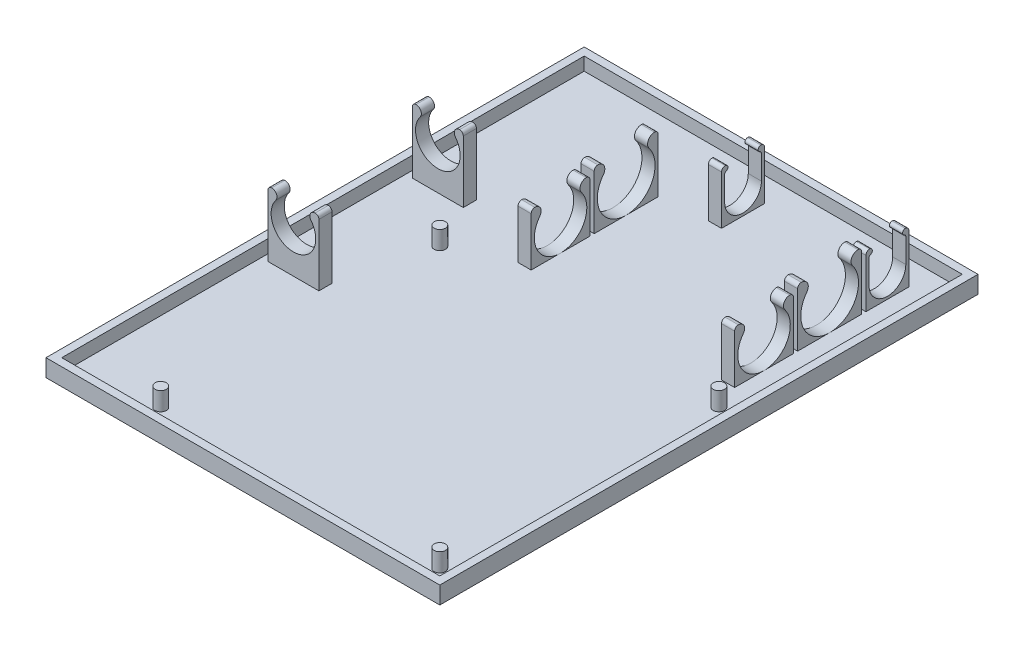
from build123d import *

# Parameters (mm, degrees)
SKETCH1_W           = 150
SKETCH1_H           = 205
SKETCH1_W_2         = 144
SKETCH1_H_2         = 199
BASE_DEPTH          = 1.6
WALLS_START         = 1.6
SKETCH1_3_W         = 150
SKETCH1_3_H         = 205
SKETCH1_3_W_2       = 144
SKETCH1_3_H_2       = 199
WALLS_DEPTH         = 5
SKETCH4_R           = 2.15
FANPEG_DEPTH        = 7
SKETCH6_W           = 5
SKETCH6_H           = 22.4
SUCKEREXTRUDE_DEPTH = 20
SUCKERCUT_DEPTH     = 5
LPATTERN1_COUNT     = 2
LPATTERN1_PITCH     = 77.5
SKETCH10_W          = 5
SKETCH10_H          = 24.4
BOSS_EXTRUDE5_DEPTH = 22
CUT_EXTRUDE2_DEPTH  = 5
LPATTERN2_COUNT     = 2
LPATTERN2_PITCH     = 77.5
SKETCH12_W          = 5
SKETCH12_H          = 16.4
BOSS_EXTRUDE6_DEPTH = 20
CUT_EXTRUDE3_DEPTH  = 5
LPATTERN3_COUNT     = 2
LPATTERN3_PITCH     = 55
SKETCH14_W          = 19.4
SKETCH14_H          = 5
BOSS_EXTRUDE7_DEPTH = 25
CUT_EXTRUDE4_DEPTH  = 5
LPATTERN4_COUNT     = 2
LPATTERN4_PITCH     = 55


with BuildPart() as part:
    # Sketch1 → Base (new body)
    # profile 1 of 2: a face of its own
    with BuildSketch(Plane(origin=(0, 0, 0), x_dir=(1, 0, 0), z_dir=(0, 1, 0))):
        Rectangle(SKETCH1_W, SKETCH1_H)
        Rectangle(SKETCH1_W_2, SKETCH1_H_2, mode=Mode.SUBTRACT)
    # profile 2 of 2: a face of its own
    with BuildSketch(Plane(origin=(0, 0, 0), x_dir=(1, 0, 0), z_dir=(0, 1, 0))):
        Rectangle(SKETCH1_W_2, SKETCH1_H_2)
    extrude(amount=BASE_DEPTH)



with BuildPart() as body_2:
    # Sketch1<3> → Walls (new body)
    with BuildSketch(Plane(origin=(0, 0, 0), x_dir=(1, 0, 0), z_dir=(0, 1, 0)).offset(WALLS_START)):
        Rectangle(SKETCH1_3_W, SKETCH1_3_H)
        Rectangle(SKETCH1_3_W_2, SKETCH1_3_H_2, mode=Mode.SUBTRACT)
    extrude(amount=WALLS_DEPTH)


with BuildPart() as part_1:
    add(part.part)

    add(body_2.part)  # FanPeg merges body 2
    # Sketch4 → FanPeg (add)
    with BuildSketch(Plane(origin=(0, 1.6, 0), x_dir=(1, 0, 0), z_dir=(0, 1, 0))):
        with Locations(Location((64.5, 14.3, 0), (0, 0, 270))):
            Circle(SKETCH4_R)
    fanpeg = extrude(amount=FANPEG_DEPTH)

    # Sketch-Pattern1: FanPeg at 3 more places
    with Locations((-106.3, 0, 0), (-106.3, 0, 106.3), (0, 0, 106.3)):
        add(fanpeg)

    # Sketch6 → SuckerExtrude (add)
    with BuildSketch(Plane(origin=(0, 1.6, 0), x_dir=(1, 0, 0), z_dir=(0, 1, 0))):
        with Locations((58.5, 35)):
            Rectangle(SKETCH6_W, SKETCH6_H)
    suckerextrude = extrude(amount=SUCKEREXTRUDE_DEPTH)

    # Sketch7 → suckerCut (cut)
    with BuildSketch(Plane(origin=(61, 0, 0), x_dir=(0, 0, -1), z_dir=(1, 0, 0))):
        with BuildLine():
            Line((46.2, 21.6), (44.785786438, 21.6))
            ThreePointArc((44.785786438, 21.6), (45.785786438, 21.185786438), (46.2, 20.185786438))
            Line((46.2, 20.185786438), (46.2, 21.6))
        make_face()
        with BuildLine():
            Line((44.785786438, 21.6), (35, 21.6))
            ThreePointArc((35, 21.6), (39.395004096, 20.582423893), (42.89555796, 17.7367878))
            ThreePointArc((42.89555796, 17.7367878), (42.635357864, 20.258141333), (44.785786438, 21.6))
        make_face()
        with BuildLine():
            ThreePointArc((27.10444204, 17.7367878), (30.604995904, 20.582423893), (35, 21.6))
            Line((35, 21.6), (25.214213562, 21.6))
            ThreePointArc((25.214213562, 21.6), (27.364642136, 20.258141333), (27.10444204, 17.7367878))
        make_face()
        with BuildLine():
            ThreePointArc((23.8, 20.185786438), (24.214213562, 21.185786438), (25.214213562, 21.6))
            Line((25.214213562, 21.6), (23.8, 21.6))
            Line((23.8, 21.6), (23.8, 20.185786438))
        make_face()
        with BuildLine():
            ThreePointArc((27.10444204, 17.7367878), (26.017576107, 7.204995904), (35, 1.6))
            Line((35, 1.6), (35, 21.6))
            ThreePointArc((35, 21.6), (30.604995904, 20.582423893), (27.10444204, 17.7367878))
        make_face()
        with BuildLine():
            Line((35, 21.6), (35, 1.6))
            ThreePointArc((35, 1.6), (42.071067812, 4.528932188), (45, 11.6))
            ThreePointArc((45, 11.6), (44.459270046, 14.843795647), (42.89555796, 17.7367878))
            ThreePointArc((42.89555796, 17.7367878), (39.395004096, 20.582423893), (35, 21.6))
        make_face()
    suckercut = extrude(amount=-SUCKERCUT_DEPTH, mode=Mode.SUBTRACT)

    # LPattern1: SuckerExtrude, suckerCut ×2
    with Locations(*[(-i * LPATTERN1_PITCH, 0, 0) for i in range(1, LPATTERN1_COUNT)]):
        add(suckerextrude)
        add(suckercut, mode=Mode.SUBTRACT)

    # Sketch10 → Boss-Extrude5 (add)
    with BuildSketch(Plane(origin=(0, 1.6, 0), x_dir=(1, 0, 0), z_dir=(0, 1, 0))):
        with Locations((58.5, 60)):
            Rectangle(SKETCH10_W, SKETCH10_H)
    boss_extrude5 = extrude(amount=BOSS_EXTRUDE5_DEPTH)

    # Sketch11 → Cut-Extrude2 (cut)
    with BuildSketch(Plane(origin=(61, 0, 0), x_dir=(0, 0, -1), z_dir=(1, 0, 0))):
        with BuildLine():
            ThreePointArc((51.304294464, 19.336817144), (50.123133377, 7.757737542), (60, 1.6))
            Line((60, 1.6), (60, 23.6))
            ThreePointArc((60, 23.6), (55.157737542, 22.476866623), (51.304294464, 19.336817144))
        make_face()
        with BuildLine():
            Line((60, 23.6), (60, 1.6))
            ThreePointArc((60, 1.6), (67.778174593, 4.821825407), (71, 12.6))
            ThreePointArc((71, 12.6), (70.407995986, 16.160002746), (68.695705536, 19.336817144))
            ThreePointArc((68.695705536, 19.336817144), (64.842262458, 22.476866623), (60, 23.6))
        make_face()
        with BuildLine():
            ThreePointArc((51.304294464, 19.336817144), (55.157737542, 22.476866623), (60, 23.6))
            Line((60, 23.6), (49.214213562, 23.6))
            ThreePointArc((49.214213562, 23.6), (51.588195778, 22.119939575), (51.304294464, 19.336817144))
        make_face()
        with BuildLine():
            ThreePointArc((47.8, 22.185786438), (48.214213562, 23.185786438), (49.214213562, 23.6))
            Line((49.214213562, 23.6), (47.8, 23.6))
            Line((47.8, 23.6), (47.8, 22.185786438))
        make_face()
        with BuildLine():
            Line((70.785786438, 23.6), (60, 23.6))
            ThreePointArc((60, 23.6), (64.842262458, 22.476866623), (68.695705536, 19.336817144))
            ThreePointArc((68.695705536, 19.336817144), (68.411804222, 22.119939575), (70.785786438, 23.6))
        make_face()
        with BuildLine():
            Line((72.2, 23.6), (70.785786438, 23.6))
            ThreePointArc((70.785786438, 23.6), (71.785786438, 23.185786438), (72.2, 22.185786438))
            Line((72.2, 22.185786438), (72.2, 23.6))
        make_face()
    cut_extrude2 = extrude(amount=-CUT_EXTRUDE2_DEPTH, mode=Mode.SUBTRACT)

    # LPattern2: Boss-Extrude5, Cut-Extrude2 ×2
    with Locations(*[(-i * LPATTERN2_PITCH, 0, 0) for i in range(1, LPATTERN2_COUNT)]):
        add(boss_extrude5)
        add(cut_extrude2, mode=Mode.SUBTRACT)

    # Sketch12 → Boss-Extrude6 (add)
    with BuildSketch(Plane(origin=(0, 1.6, 0), x_dir=(1, 0, 0), z_dir=(0, 1, 0))):
        with Locations((58.5, 82)):
            Rectangle(SKETCH12_W, SKETCH12_H)
    boss_extrude6 = extrude(amount=BOSS_EXTRUDE6_DEPTH)

    # Sketch13 → Cut-Extrude3 (cut)
    with BuildSketch(Plane(origin=(61, 0, 0), x_dir=(0, 0, -1), z_dir=(1, 0, 0))):
        with BuildLine():
            Line((75, 18.77951536), (75, 9.6))
            ThreePointArc((75, 9.6), (77.050252532, 14.549747468), (82, 16.6))
            Line((82, 16.6), (82, 21.6))
            Line((82, 21.6), (75.214213562, 21.6))
            ThreePointArc((75.214213562, 21.6), (76.230059772, 20.749616137), (75.571668571, 19.6))
            ThreePointArc((75.571668571, 19.6), (75.157009996, 19.27951536), (75, 18.77951536))
        make_face()
        with BuildLine():
            Line((82, 21.6), (82, 16.6))
            ThreePointArc((82, 16.6), (86.949747468, 14.549747468), (89, 9.6))
            Line((89, 9.6), (89, 18.77951536))
            ThreePointArc((89, 18.77951536), (88.842990004, 19.27951536), (88.428331429, 19.6))
            ThreePointArc((88.428331429, 19.6), (87.769940228, 20.749616137), (88.785786438, 21.6))
            Line((88.785786438, 21.6), (82, 21.6))
        make_face()
        with BuildLine():
            ThreePointArc((82, 16.6), (77.050252532, 14.549747468), (75, 9.6))
            ThreePointArc((75, 9.6), (77.050252532, 4.650252532), (82, 2.6))
            Line((82, 2.6), (82, 16.6))
        make_face()
        with BuildLine():
            ThreePointArc((89, 9.6), (86.949747468, 14.549747468), (82, 16.6))
            Line((82, 16.6), (82, 2.6))
            ThreePointArc((82, 2.6), (86.949747468, 4.650252532), (89, 9.6))
        make_face()
        with BuildLine():
            Line((90.2, 21.6), (88.785786438, 21.6))
            ThreePointArc((88.785786438, 21.6), (89.785786438, 21.185786438), (90.2, 20.185786438))
            Line((90.2, 20.185786438), (90.2, 21.6))
        make_face()
        with BuildLine():
            ThreePointArc((73.8, 20.185786438), (74.214213562, 21.185786438), (75.214213562, 21.6))
            Line((75.214213562, 21.6), (73.8, 21.6))
            Line((73.8, 21.6), (73.8, 20.185786438))
        make_face()
    cut_extrude3 = extrude(amount=-CUT_EXTRUDE3_DEPTH, mode=Mode.SUBTRACT)

    # LPattern3: Boss-Extrude6, Cut-Extrude3 ×2
    with Locations(*[(-i * LPATTERN3_PITCH, 0, 0) for i in range(1, LPATTERN3_COUNT)]):
        add(boss_extrude6)
        add(cut_extrude3, mode=Mode.SUBTRACT)

    # Sketch14 → Boss-Extrude7 (add)
    with BuildSketch(Plane(origin=(0, 1.6, 0), x_dir=(1, 0, 0), z_dir=(0, 1, 0))):
        with Locations((-59.75, -21)):
            Rectangle(SKETCH14_W, SKETCH14_H)
    boss_extrude7 = extrude(amount=BOSS_EXTRUDE7_DEPTH)

    # Sketch15 → Cut-Extrude4 (cut)
    with BuildSketch(Plane.XY.offset(23.5)):
        with BuildLine():
            ThreePointArc((-53.054728703, 23.336730111), (-56.025903193, 25.740752775), (-59.75, 26.6))
            Line((-59.75, 26.6), (-59.75, 9.6))
            ThreePointArc((-59.75, 9.6), (-53.73959236, 12.08959236), (-51.25, 18.1))
            ThreePointArc((-51.25, 18.1), (-51.713837793, 20.869493995), (-53.054728703, 23.336730111))
        make_face()
        with BuildLine():
            Line((-59.75, 9.6), (-59.75, 26.6))
            ThreePointArc((-59.75, 26.6), (-63.474096807, 25.740752775), (-66.445271297, 23.336730111))
            ThreePointArc((-66.445271297, 23.336730111), (-67.390752775, 14.375903193), (-59.75, 9.6))
        make_face()
        with BuildLine():
            ThreePointArc((-66.445271297, 23.336730111), (-63.474096807, 25.740752775), (-59.75, 26.6))
            Line((-59.75, 26.6), (-68.035786438, 26.6))
            ThreePointArc((-68.035786438, 26.6), (-66.220664625, 25.465446074), (-66.445271297, 23.336730111))
        make_face()
        with BuildLine():
            Line((-51.464213562, 26.6), (-59.75, 26.6))
            ThreePointArc((-59.75, 26.6), (-56.025903193, 25.740752775), (-53.054728703, 23.336730111))
            ThreePointArc((-53.054728703, 23.336730111), (-53.279335375, 25.465446074), (-51.464213562, 26.6))
        make_face()
        with BuildLine():
            Line((-50.05, 26.6), (-51.464213562, 26.6))
            ThreePointArc((-51.464213562, 26.6), (-50.464213562, 26.185786438), (-50.05, 25.185786438))
            Line((-50.05, 25.185786438), (-50.05, 26.6))
        make_face()
        with BuildLine():
            ThreePointArc((-69.45, 25.185786438), (-69.035786438, 26.185786438), (-68.035786438, 26.6))
            Line((-68.035786438, 26.6), (-69.45, 26.6))
            Line((-69.45, 26.6), (-69.45, 25.185786438))
        make_face()
    cut_extrude4 = extrude(amount=-CUT_EXTRUDE4_DEPTH, mode=Mode.SUBTRACT)

    # LPattern4: Boss-Extrude7, Cut-Extrude4 ×2
    with Locations(*[(0, 0, -i * LPATTERN4_PITCH) for i in range(1, LPATTERN4_COUNT)]):
        add(boss_extrude7)
        add(cut_extrude4, mode=Mode.SUBTRACT)


solid = part_1.part
